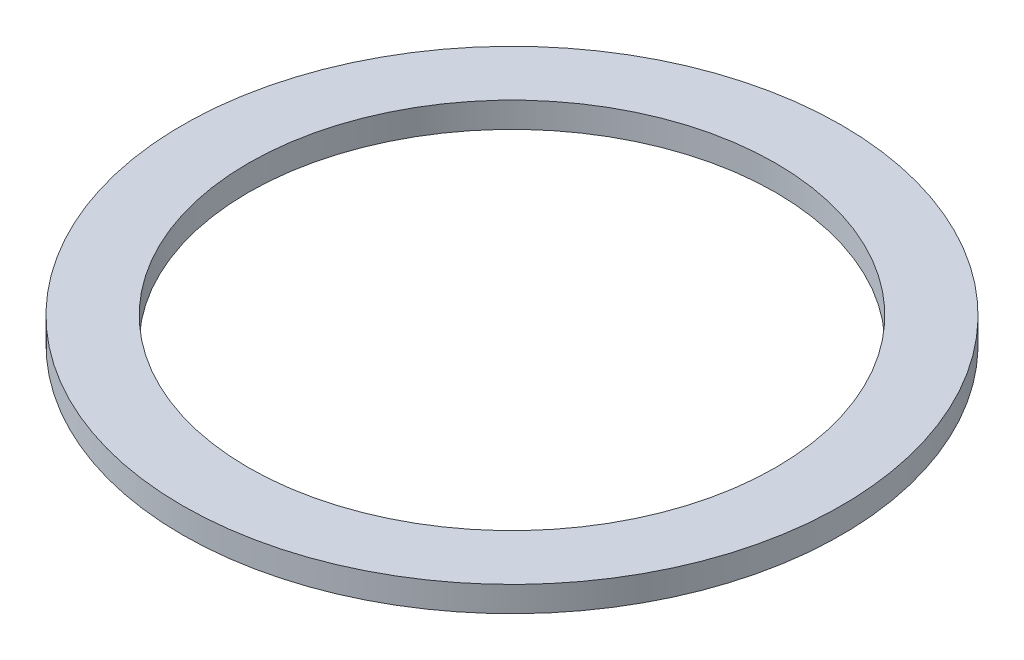
from build123d import *

# Parameters (mm, degrees)
SKETCH2_R           = 49.53
SKETCH2_R_2         = 39.624
BOSS_EXTRUDE1_DEPTH = 3.81


with BuildPart() as part:
    # Sketch2 → Boss-Extrude1 (new body)
    with BuildSketch(Plane(origin=(0, 0, 0), x_dir=(1, 0, 0), z_dir=(0, 1, 0))):
        with Locations(Location((0, 0, 0), (0, 0, 90))):
            Circle(SKETCH2_R)
        with Locations(Location((0, 0, 0), (0, 0, 90))):
            Circle(SKETCH2_R_2, mode=Mode.SUBTRACT)
    extrude(amount=BOSS_EXTRUDE1_DEPTH)


solid = part.part
